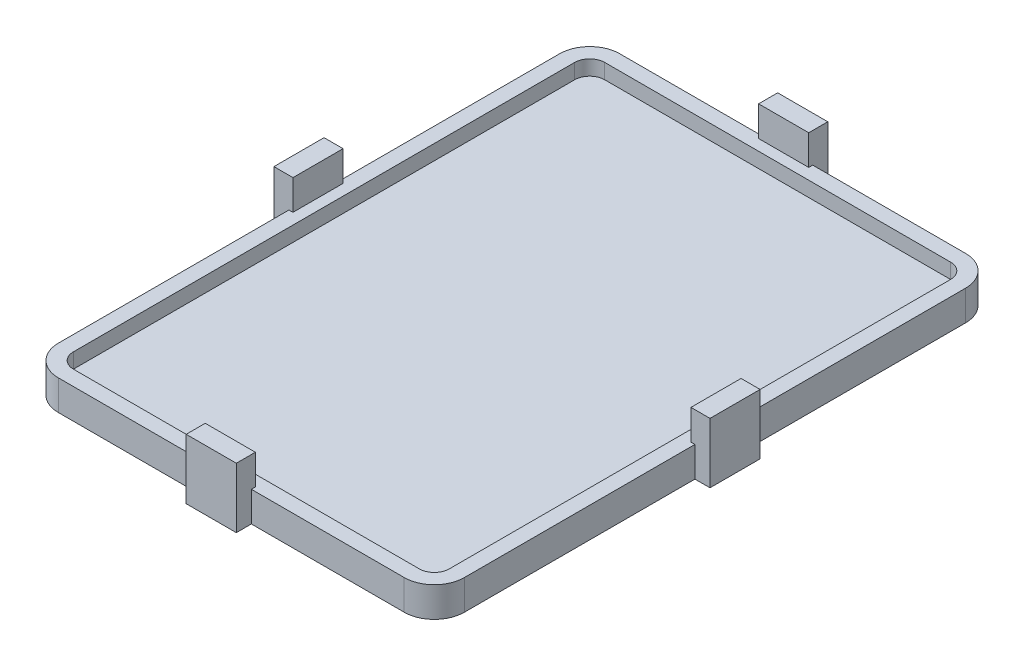
from build123d import *

# Parameters (mm, degrees)
SKETCH1_W           = 40.5
SKETCH1_H           = 56
BOSS_EXTRUDE1_DEPTH = 3
FILLET1_R           = 3
SHELL1_T            = -1.5
SKETCH2_W           = 5
SKETCH2_H           = 3
BOSS_EXTRUDE2_DEPTH = 1.5
SKETCH3_W           = 1.9
SKETCH3_H           = 5
BOSS_EXTRUDE3_DEPTH = 3
SKETCH8_W           = 5
SKETCH8_H           = 3
BOSS_EXTRUDE5_DEPTH = 1.5
SKETCH9_W           = 5
SKETCH9_H           = 1.9
BOSS_EXTRUDE6_DEPTH = 3


with BuildPart() as part:
    # Sketch1 → Boss-Extrude1 (new body)
    with BuildSketch(Plane(origin=(0, 0, 0), x_dir=(1, 0, 0), z_dir=(0, 1, 0))):
        with Locations((20.25, 28)):
            Rectangle(SKETCH1_W, SKETCH1_H)
    extrude(amount=BOSS_EXTRUDE1_DEPTH)

    # Fillet1
    fillet1_edges = [part.edges().sort_by_distance(p)[0] for p in [
        (0, 1.5, -56),
        (40.5, 1.5, -56),
        (40.5, 1.5, 0),
        (0, 1.5, 0),
    ]]
    fillet(fillet1_edges, radius=FILLET1_R)

    # Shell1
    shell1_openings = [part.faces().sort_by_distance(p)[0] for p in [
        (20.25, 3, -28),
    ]]
    offset(amount=SHELL1_T, openings=shell1_openings, kind=Kind.INTERSECTION)

    # Sketch2 → Boss-Extrude2 (add)
    with BuildSketch(Plane.ZY):
        with Locations((-28.5, 1.5)):
            Rectangle(SKETCH2_W, SKETCH2_H)
    boss_extrude2 = extrude(amount=BOSS_EXTRUDE2_DEPTH)

    # Sketch3 → Boss-Extrude3 (add)
    with BuildSketch(Plane(origin=(0, 3, 0), x_dir=(1, 0, 0), z_dir=(0, 1, 0))):
        with Locations((-0.55, 28.5)):
            Rectangle(SKETCH3_W, SKETCH3_H)
    boss_extrude3 = extrude(amount=BOSS_EXTRUDE3_DEPTH)

    # Sketch8 → Boss-Extrude5 (add)
    with BuildSketch(Plane.XY):
        with Locations((19.75, 1.5)):
            Rectangle(SKETCH8_W, SKETCH8_H)
    boss_extrude5 = extrude(amount=BOSS_EXTRUDE5_DEPTH)

    # Sketch9 → Boss-Extrude6 (add)
    with BuildSketch(Plane(origin=(0, 3, 0), x_dir=(1, 0, 0), z_dir=(0, 1, 0))):
        with Locations((19.75, -0.55)):
            Rectangle(SKETCH9_W, SKETCH9_H)
    boss_extrude6 = extrude(amount=BOSS_EXTRUDE6_DEPTH)

    # Mirror3: Boss-Extrude2, Boss-Extrude3 across plane
    add(boss_extrude2.mirror(Plane(origin=(20.25, 0, 0), x_dir=(0, 0, 1), z_dir=(1, 0, 0))))
    add(boss_extrude3.mirror(Plane(origin=(20.25, 0, 0), x_dir=(0, 0, 1), z_dir=(1, 0, 0))))

    # Mirror4: Boss-Extrude5, Boss-Extrude6 across plane
    add(boss_extrude5.mirror(Plane(origin=(0, 0, -28), x_dir=(1, 0, 0), z_dir=(0, 0, -1))))
    add(boss_extrude6.mirror(Plane(origin=(0, 0, -28), x_dir=(1, 0, 0), z_dir=(0, 0, -1))))


solid = part.part
